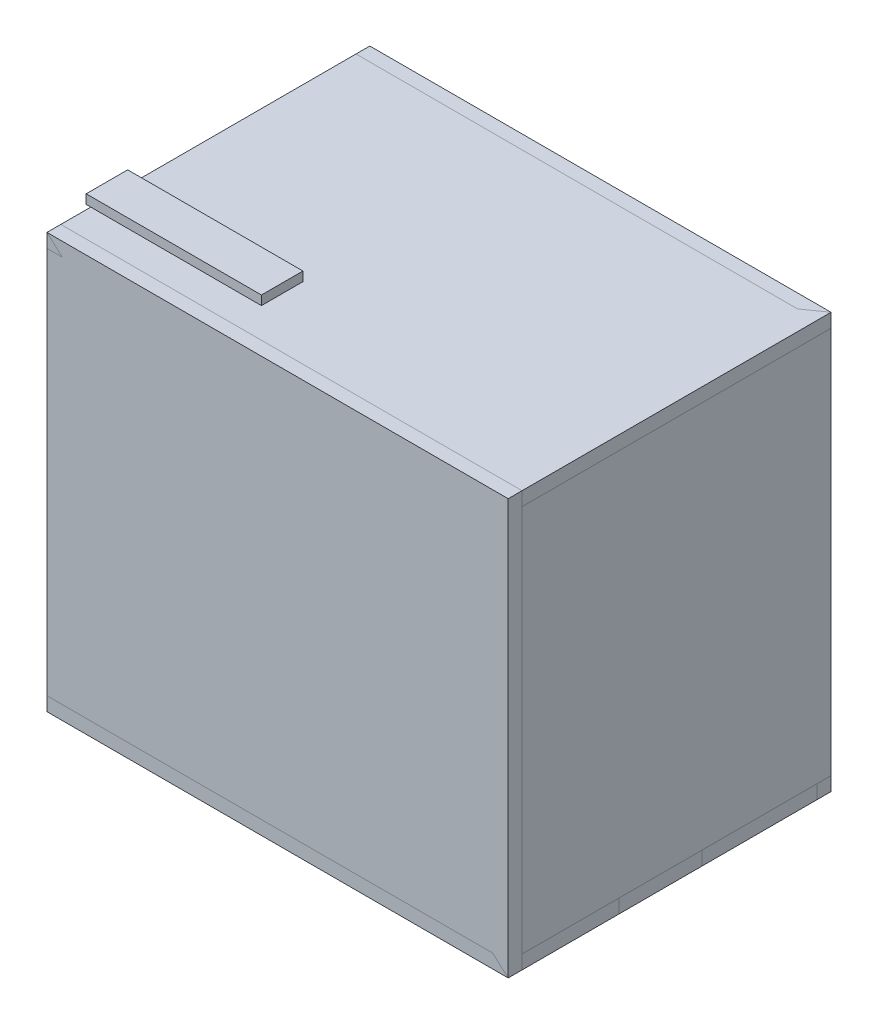
from build123d import *

# Parameters (mm, degrees)
BOTTOM_START                                   = -35
SKETCH_1_W                                     = 100
SKETCH_1_H                                     = 90
BOTTOM_PLATE_100_X_90_X_3_MM_DEPTH             = 3
BACK_START                                     = -35
SKETCH_2_W                                     = 100
SKETCH_2_H                                     = 3
BACK_WALL_3_MM_DEPTH                           = 70
LEFT_START                                     = -35
SKETCH_3_W                                     = 3
SKETCH_3_H                                     = 84
LEFT_SIDE_WALL_3_MM_DEPTH                      = 70
RIGHT_START                                    = -35
SKETCH_4_W                                     = 3
SKETCH_4_H                                     = 84
RIGHT_SIDE_WALL_3_MM_DEPTH                     = 70
FRONT_START                                    = -35
SKETCH_5_W                                     = 100
SKETCH_5_H                                     = 3
FRONT_WALL_LOWER_FRAME_BELOW_HC_SR04_WIN_DEPTH = 28
FRONT_START_2                                  = 11
SKETCH_6_W                                     = 100
SKETCH_6_H                                     = 3
FRONT_WALL_UPPER_FRAME_ABOVE_HC_SR04_WIN_DEPTH = 24
FRONT_START_3                                  = -7
SKETCH_7_W                                     = 27
SKETCH_7_H                                     = 3
FRONT_WALL_LEFT_FRAME_DEPTH                    = 18
SKETCH_8_W                                     = 27
SKETCH_8_H                                     = 3
FRONT_WALL_RIGHT_FRAME_DEPTH                   = 18
TRANSPARENT_START                              = 32
SKETCH_9_W                                     = 100
SKETCH_9_H                                     = 90
TRANSPARENT_TOP_LID_REMOVABLE_DEPTH            = 3
SERVO_START                                    = 6
SKETCH_10_W                                    = 36
SKETCH_10_H                                    = 28
SERVO_SUPPORT_PLATFORM_36_X_28_X_4_MM_DEPTH    = 4
BATTERY_START                                  = -27
SKETCH_11_W                                    = 64
SKETCH_11_H                                    = 44
BATTERY_TRAY_BASE_60_X_40_MM_DEPTH             = 2
PCB_START                                      = -33
SKETCH_12_R                                    = 3
PCB_STANDOFF_1_M3_CLEARANCE_MARKER_DEPTH       = 14
SKETCH_13_R                                    = 3
PCB_STANDOFF_2_M3_CLEARANCE_MARKER_DEPTH       = 14
SKETCH_14_R                                    = 3
PCB_STANDOFF_3_M3_CLEARANCE_MARKER_DEPTH       = 14
SKETCH_15_R                                    = 3
PCB_STANDOFF_4_M3_CLEARANCE_MARKER_DEPTH       = 14
CASE_START                                     = 18.5
SKETCH_16_W                                    = 38
SKETCH_16_H                                    = 2
CASE_LABEL_PLATE_CASE_100X90X70_DEPTH          = 9


with BuildPart() as part:
    # 草图1 → bottom plate - 100 x 90 x 3 mm (new body)
    with BuildSketch(Plane.XY.offset(BOTTOM_START)):
        Rectangle(SKETCH_1_W, SKETCH_1_H)
    extrude(amount=BOTTOM_PLATE_100_X_90_X_3_MM_DEPTH)


with BuildPart() as body_2:
    # 草图2 → back wall - 3 mm (new body)
    with BuildSketch(Plane.XY.offset(BACK_START)):
        with Locations((0, 43.5)):
            Rectangle(SKETCH_2_W, SKETCH_2_H)
    extrude(amount=BACK_WALL_3_MM_DEPTH)


with BuildPart() as body_3:
    # 草图3 → left side wall - 3 mm (new body)
    with BuildSketch(Plane.XY.offset(LEFT_START)):
        with Locations((-48.5, 0)):
            Rectangle(SKETCH_3_W, SKETCH_3_H)
    extrude(amount=LEFT_SIDE_WALL_3_MM_DEPTH)


with BuildPart() as body_4:
    # 草图4 → right side wall - 3 mm (new body)
    with BuildSketch(Plane.XY.offset(RIGHT_START)):
        with Locations((48.5, 0)):
            Rectangle(SKETCH_4_W, SKETCH_4_H)
    extrude(amount=RIGHT_SIDE_WALL_3_MM_DEPTH)


with BuildPart() as body_5:
    # 草图5 → front wall lower frame below HC-SR04 window (new body)
    with BuildSketch(Plane.XY.offset(FRONT_START)):
        with Locations((0, -43.5)):
            Rectangle(SKETCH_5_W, SKETCH_5_H)
    extrude(amount=FRONT_WALL_LOWER_FRAME_BELOW_HC_SR04_WIN_DEPTH)


with BuildPart() as body_6:
    # 草图6 → front wall upper frame above HC-SR04 window (new body)
    with BuildSketch(Plane.XY.offset(FRONT_START_2)):
        with Locations((0, -43.5)):
            Rectangle(SKETCH_6_W, SKETCH_6_H)
    extrude(amount=FRONT_WALL_UPPER_FRAME_ABOVE_HC_SR04_WIN_DEPTH)


with BuildPart() as body_7:
    # 草图7 → front wall left frame (new body)
    with BuildSketch(Plane.XY.offset(FRONT_START_3)):
        with Locations((-36.5, -43.5)):
            Rectangle(SKETCH_7_W, SKETCH_7_H)
    extrude(amount=FRONT_WALL_LEFT_FRAME_DEPTH)


with BuildPart() as body_8:
    # 草图8 → front wall right frame (new body)
    with BuildSketch(Plane.XY.offset(FRONT_START_3)):
        with Locations((36.5, -43.5)):
            Rectangle(SKETCH_8_W, SKETCH_8_H)
    extrude(amount=FRONT_WALL_RIGHT_FRAME_DEPTH)


with BuildPart() as body_9:
    # 草图9 → transparent top lid - removable (new body)
    with BuildSketch(Plane.XY.offset(TRANSPARENT_START)):
        Rectangle(SKETCH_9_W, SKETCH_9_H)
    extrude(amount=TRANSPARENT_TOP_LID_REMOVABLE_DEPTH)


with BuildPart() as body_10:
    # 草图10 → servo support platform - 36 x 28 x 4 mm (new body)
    with BuildSketch(Plane.XY.offset(SERVO_START)):
        Rectangle(SKETCH_10_W, SKETCH_10_H)
    extrude(amount=SERVO_SUPPORT_PLATFORM_36_X_28_X_4_MM_DEPTH)


with BuildPart() as body_11:
    # 草图11 → battery tray base - 60 x 40 mm (new body)
    with BuildSketch(Plane.XY.offset(BATTERY_START)):
        with Locations((0, 4)):
            Rectangle(SKETCH_11_W, SKETCH_11_H)
    extrude(amount=BATTERY_TRAY_BASE_60_X_40_MM_DEPTH)


with BuildPart() as body_12:
    # 草图12 → PCB standoff 1 - M3 clearance marker (new body)
    with BuildSketch(Plane.XY.offset(PCB_START)):
        with Locations((-32, -24)):
            Circle(SKETCH_12_R)
    extrude(amount=PCB_STANDOFF_1_M3_CLEARANCE_MARKER_DEPTH)


with BuildPart() as body_13:
    # 草图13 → PCB standoff 2 - M3 clearance marker (new body)
    with BuildSketch(Plane.XY.offset(PCB_START)):
        with Locations((32, -24)):
            Circle(SKETCH_13_R)
    extrude(amount=PCB_STANDOFF_2_M3_CLEARANCE_MARKER_DEPTH)


with BuildPart() as body_14:
    # 草图14 → PCB standoff 3 - M3 clearance marker (new body)
    with BuildSketch(Plane.XY.offset(PCB_START)):
        with Locations((-32, 24)):
            Circle(SKETCH_14_R)
    extrude(amount=PCB_STANDOFF_3_M3_CLEARANCE_MARKER_DEPTH)


with BuildPart() as body_15:
    # 草图15 → PCB standoff 4 - M3 clearance marker (new body)
    with BuildSketch(Plane.XY.offset(PCB_START)):
        with Locations((32, 24)):
            Circle(SKETCH_15_R)
    extrude(amount=PCB_STANDOFF_4_M3_CLEARANCE_MARKER_DEPTH)


with BuildPart() as body_16:
    # 草图16 → case label plate - CASE 100x90x70 (new body)
    with BuildSketch(Plane.XY.offset(CASE_START)):
        with Locations((-30, 48)):
            Rectangle(SKETCH_16_W, SKETCH_16_H)
    extrude(amount=CASE_LABEL_PLATE_CASE_100X90X70_DEPTH)


solid = Compound([part.part, body_2.part, body_3.part, body_4.part, body_5.part, body_6.part, body_7.part, body_8.part, body_9.part, body_10.part, body_11.part, body_12.part, body_13.part, body_14.part, body_15.part, body_16.part])
